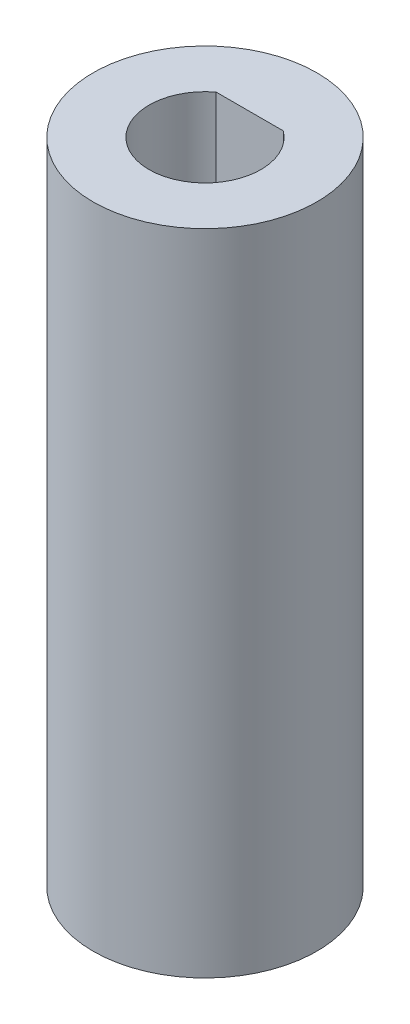
from build123d import *

# Parameters (mm, degrees)
SKETCH2_R           = 5
BOSS_EXTRUDE1_DEPTH = 29


with BuildPart() as part:
    # Sketch2 → Boss-Extrude1 (new body)
    # profile 1 of 2: a face of its own
    with BuildSketch(Plane(origin=(0, 0, 0), x_dir=(1, 0, 0), z_dir=(0, 1, 0))):
        with Locations(Location((0, 0, 0), (0, 0, 90))):
            Circle(SKETCH2_R)
        with BuildLine():
            ThreePointArc((2.5, 0), (-1.118033989, -2.236067977), (-1.5, 2))
            ThreePointArc((-1.5, 2), (0, 2.5), (1.5, 2))
            ThreePointArc((1.5, 2), (2.236067977, 1.118033989), (2.5, 0))
        make_face(mode=Mode.SUBTRACT)
    # profile 2 of 2: a face of its own
    with BuildSketch(Plane(origin=(0, 0, 0), x_dir=(1, 0, 0), z_dir=(0, 1, 0))):
        with BuildLine():
            Line((-1.5, 2), (1.5, 2))
            ThreePointArc((1.5, 2), (0, 2.5), (-1.5, 2))
        make_face()
    extrude(amount=BOSS_EXTRUDE1_DEPTH)


solid = part.part
